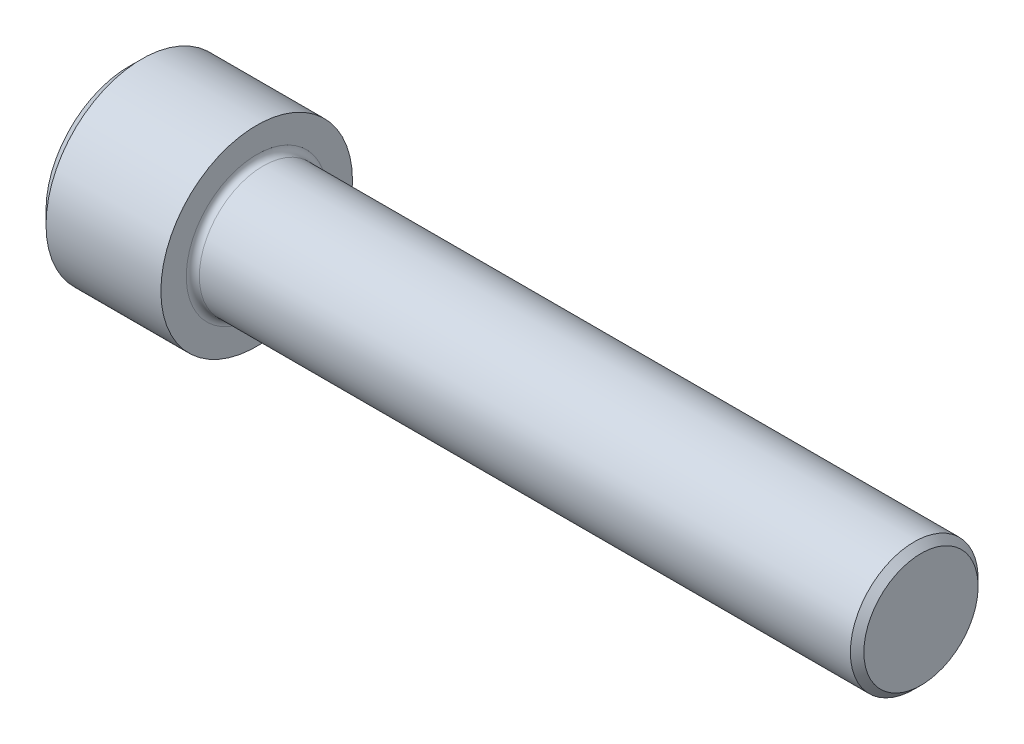
from build123d import *

# Parameters (mm, degrees)
FILLET1_R   = 0.8128
HEX_2_DEPTH = 7.7978


with BuildPart() as part:
    # BodySke → Base-Revolve (revolve)
    with BuildSketch(Plane.XY, mode=Mode.PRIVATE) as base_revolve_sk:
        Polygon((0, 0), (0, 10.30605), (1.6002, 11.90625), (15.875, 11.90625), (15.875, 7.9375), (97.58553, 7.9375), (98.425, 7.09803), (98.425, 0), align=None)
    revolve(base_revolve_sk.sketch.rotate(Axis((-31.75, 0, 0), (1, 0, 0)), 90), axis=Axis((-31.75, 0, 0), (1, 0, 0)))

    # Fillet1
    fillet1_edges = [part.edges().sort_by_distance(p)[0] for p in [
        (15.875, 0, -7.9375),
    ]]
    fillet(fillet1_edges, radius=FILLET1_R)

    # Sketch2 → Hex-PreBroach (revolve, cut)
    with BuildSketch(Plane.XY, mode=Mode.PRIVATE) as hex_prebroach_sk:
        Polygon((0, 6.35), (7.7978, 6.35), (11.463974209, 0), (0, 0), align=None)
    revolve(hex_prebroach_sk.sketch.rotate(Axis((0, 0, 0), (1, 0, 0)), 90), axis=Axis((0, 0, 0), (1, 0, 0)), mode=Mode.SUBTRACT)

    # Sketch3 → Hex 2 (cut)
    with BuildSketch(Plane(origin=(0, 0, 0), x_dir=(0, 0.500000000000001, 0.866025403784438), z_dir=(-1, 0, 0))):
        Polygon((3.666174209, 6.35), (-3.666174209, 6.35), (-7.332348419, 0), (-3.666174209, -6.35), (3.666174209, -6.35), (7.332348419, 0), align=None)
    extrude(amount=-HEX_2_DEPTH, mode=Mode.SUBTRACT)


solid = part.part
